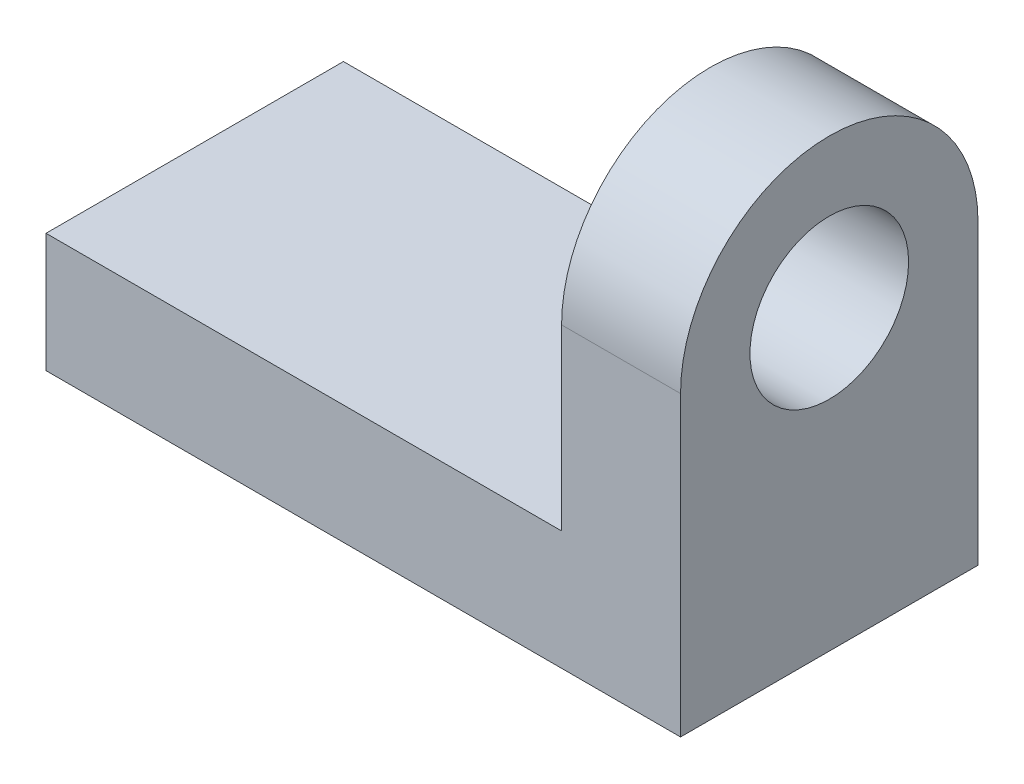
from build123d import *

# Parameters (mm, degrees)
CROQUIS1_W              = 130
CROQUIS1_H              = 75
SALIENTE_EXTRUIR1_DEPTH = 30
SALIENTE_EXTRUIR2_DEPTH = 30
CROQUIS3_R              = 20
CORTAR_EXTRUIR1_DEPTH   = 62


with BuildPart() as part:
    # Croquis1 → Saliente-Extruir1 (new body)
    with BuildSketch(Plane(origin=(0, 0, 0), x_dir=(1, 0, 0), z_dir=(0, 1, 0))):
        Rectangle(CROQUIS1_W, CROQUIS1_H)
    extrude(amount=SALIENTE_EXTRUIR1_DEPTH)

    # Croquis2 → Saliente-Extruir2 (add)
    with BuildSketch(Plane(origin=(65, 0, 0), x_dir=(0, 0, -1), z_dir=(1, 0, 0))):
        with BuildLine():
            Line((-37.5, 0), (37.5, 0))
            Line((37.5, 0), (37.5, 75))
            ThreePointArc((37.5, 75), (0, 112.5), (-37.5, 75))
            Line((-37.5, 75), (-37.5, 0))
        make_face()
    extrude(amount=SALIENTE_EXTRUIR2_DEPTH)

    # Croquis3 → Cortar-Extruir1 (cut)
    with BuildSketch(Plane(origin=(95, 0, 0), x_dir=(0, 0, -1), z_dir=(1, 0, 0))):
        with Locations((0, 75)):
            Circle(CROQUIS3_R)
    extrude(amount=-CORTAR_EXTRUIR1_DEPTH, mode=Mode.SUBTRACT)


solid = part.part
